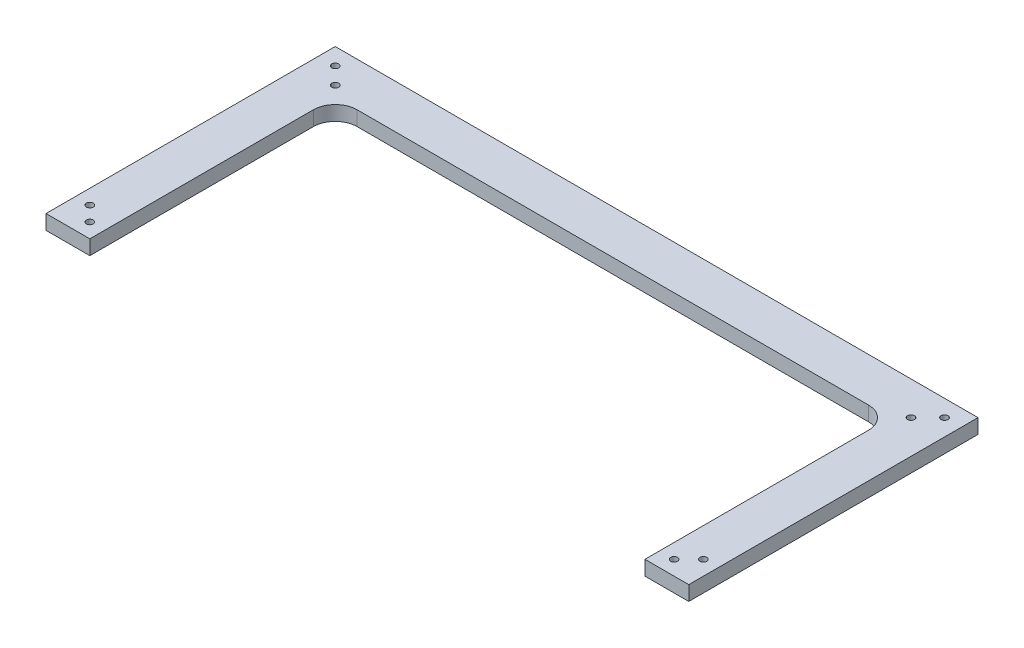
from build123d import *

# Parameters (mm, degrees)
BOSS_EXTRUDE1_DEPTH = 6.35
FILLET1_R           = 9.525
SKETCH2_R           = 1.5
CUT_EXTRUDE1_DEPTH  = 154.324560084


with BuildPart() as part:
    # Sketch1 → Boss-Extrude1 (new body)
    with BuildSketch(Plane(origin=(0, 0, 0), x_dir=(1, 0, 0), z_dir=(0, 1, 0))):
        Polygon((-120.65, -62.865), (-120.65, 43.815), (120.65, 43.815), (120.65, -62.865), (139.7, -62.865), (139.7, 62.865), (-139.7, 62.865), (-139.7, -62.865), align=None)
    extrude(amount=-BOSS_EXTRUDE1_DEPTH)

    # Fillet1
    fillet1_edges = [part.edges().sort_by_distance(p)[0] for p in [
        (120.65, -3.175, -43.815),
        (-120.65, -3.175, -43.815),
    ]]
    fillet(fillet1_edges, radius=FILLET1_R)

    # Sketch2 → Cut-Extrude1 (cut, through all)
    with BuildSketch(Plane(origin=(0, 0, 0), x_dir=(1, 0, 0), z_dir=(0, 1, 0))):
        with Locations(Location((-133.35, -50.165, 0), (0, 0, 270))):
            Circle(SKETCH2_R)
        with Locations(Location((-127, -56.515, 0), (0, 0, 270))):
            Circle(SKETCH2_R)
        with Locations(Location((-132.42006403, 55.58506403, 0), (0, 0, 270))):
            Circle(SKETCH2_R)
        with Locations(Location((-125.140128061, 48.305128061, 0), (0, 0, 270))):
            Circle(SKETCH2_R)
        with Locations(Location((125.140128061, 48.305128061, 0), (0, 0, 90))):
            Circle(SKETCH2_R)
        with Locations(Location((132.42006403, 55.58506403, 0), (0, 0, 90))):
            Circle(SKETCH2_R)
        with Locations(Location((127, -56.515, 0), (0, 0, 90))):
            Circle(SKETCH2_R)
        with Locations(Location((133.35, -50.165, 0), (0, 0, 90))):
            Circle(SKETCH2_R)
    extrude(amount=-CUT_EXTRUDE1_DEPTH, mode=Mode.SUBTRACT)


solid = part.part
